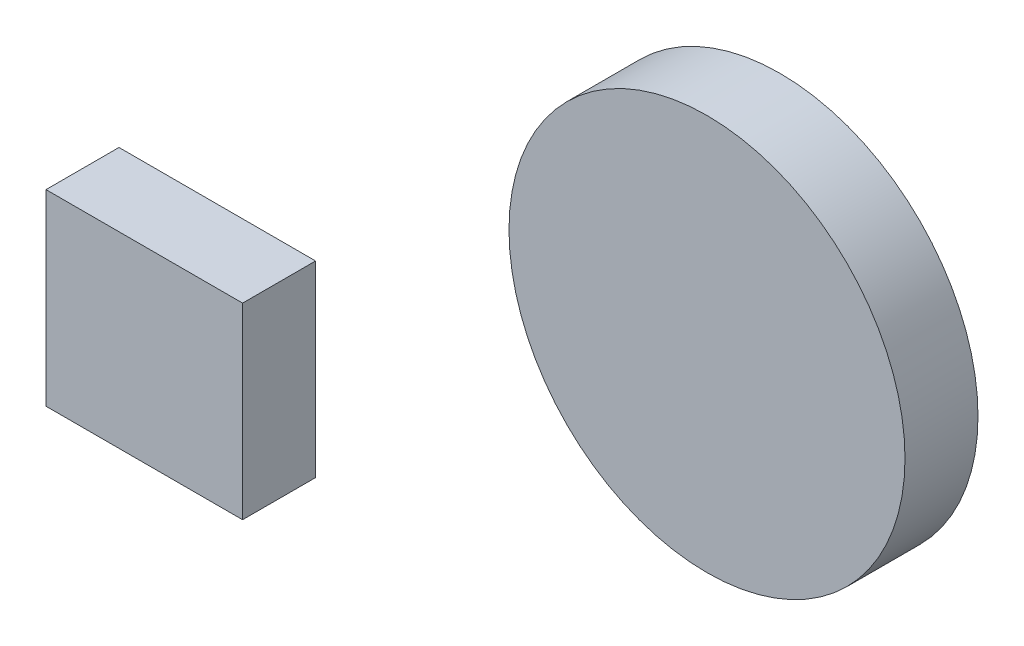
from build123d import *

# Parameters (mm, degrees)
SKETCH1_R           = 27.12492427
BOSS_EXTRUDE1_DEPTH = 10
SKETCH2_W           = 26.93082218
SKETCH2_H           = 25.702398712
BOSS_EXTRUDE2_DEPTH = 10


with BuildPart() as part:
    # Sketch1 → Boss-Extrude1 (new body)
    with BuildSketch(Plane.XY):
        with Locations((34.312919793, 34.457095292)):
            Circle(SKETCH1_R)
    extrude(amount=BOSS_EXTRUDE1_DEPTH)


with BuildPart() as body_2:
    # Sketch2 → Boss-Extrude2 (new body)
    with BuildSketch(Plane.XY.offset(10)):
        with Locations((-32.770372386, 4.658042558)):
            Rectangle(SKETCH2_W, SKETCH2_H)
    extrude(amount=BOSS_EXTRUDE2_DEPTH)


solid = Compound([part.part, body_2.part])
